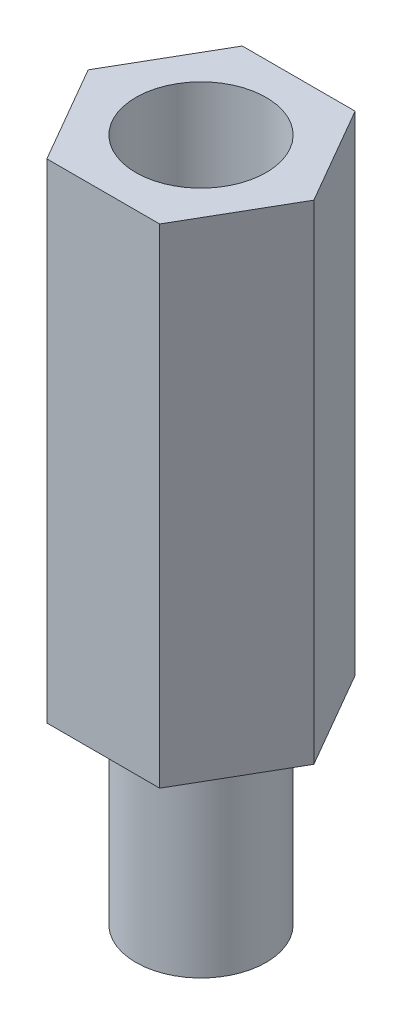
from build123d import *

# Parameters (mm, degrees)
SKETCH_2_R      = 2
EXTRUDE_1_DEPTH = 15
SKETCH_2_2_R    = 2
EXTRUDE_2_DEPTH = 6


with BuildPart() as part:
    # 草图2 → 凸台-拉伸1 (new body)
    with BuildSketch(Plane(origin=(0, 0, 0), x_dir=(1, 0, 0), z_dir=(0, 1, 0))):
        Polygon((3.464101615, 0), (1.732050808, 3), (-1.732050808, 3), (-3.464101615, 0), (-1.732050808, -3), (1.732050808, -3), align=None)
        Circle(SKETCH_2_R, mode=Mode.SUBTRACT)
    extrude(amount=EXTRUDE_1_DEPTH)


with BuildPart() as body_2:
    # 草图2<2> → 凸台-拉伸2 (new body)
    with BuildSketch(Plane(origin=(0, 0, 0), x_dir=(1, 0, 0), z_dir=(0, 1, 0))):
        Circle(SKETCH_2_2_R)
    extrude(amount=-EXTRUDE_2_DEPTH)


solid = Compound([part.part, body_2.part])
